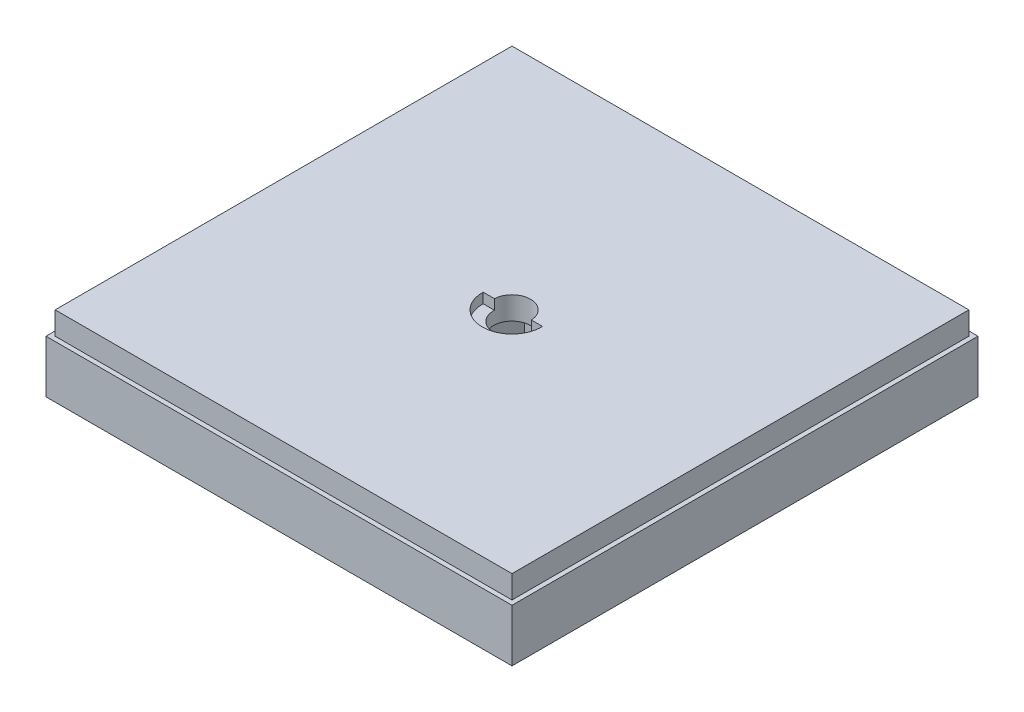
from build123d import *

# Parameters (mm, degrees)
SKETCH1_W           = 102
SKETCH1_H           = 102
BOSS_EXTRUDE1_DEPTH = 11.5
SKETCH2_W           = 100
SKETCH2_H           = 100
SKETCH2_R           = 4.05
BOSS_EXTRUDE2_DEPTH = 5
SKETCH3_R           = 8
CUT_EXTRUDE1_DEPTH  = 7
CUT_EXTRUDE2_DEPTH  = 2.2


with BuildPart() as part:
    # Sketch1 → Boss-Extrude1 (new body)
    with BuildSketch(Plane(origin=(0, 0, 0), x_dir=(1, 0, 0), z_dir=(0, 1, 0))):
        with Locations((-51, 51)):
            Rectangle(SKETCH1_W, SKETCH1_H)
        Polygon((-43.494446501, 51), (-47.24722325, 57.5), (-54.75277675, 57.5), (-58.505553499, 51), (-54.75277675, 44.5), (-47.24722325, 44.5), align=None, mode=Mode.SUBTRACT)
    extrude(amount=BOSS_EXTRUDE1_DEPTH)

    # Sketch2 → Boss-Extrude2 (add)
    with BuildSketch(Plane(origin=(0, 11.5, 0), x_dir=(1, 0, 0), z_dir=(0, 1, 0))):
        with Locations((-51, 51)):
            Rectangle(SKETCH2_W, SKETCH2_H)
        with Locations(Location((-51, 51, 0), (0, 0, 270))):
            Circle(SKETCH2_R, mode=Mode.SUBTRACT)
    extrude(amount=BOSS_EXTRUDE2_DEPTH)

    # Sketch3 → Cut-Extrude1 (cut)
    with BuildSketch(Plane.XZ):
        with Locations(Location((-51, -51, 0), (0, 0, 270))):
            Circle(SKETCH3_R)
    extrude(amount=-CUT_EXTRUDE1_DEPTH, mode=Mode.SUBTRACT)

    # Sketch4 → Cut-Extrude2 (cut)
    with BuildSketch(Plane(origin=(0, 16.5, 0), x_dir=(1, 0, 0), z_dir=(0, 1, 0))):
        with BuildLine():
            Line((-57.496922348, 51.2), (-44.503077652, 51.2))
            ThreePointArc((-44.503077652, 51.2), (-51, 44.5), (-57.496922348, 51.2))
        make_face()
    extrude(amount=-CUT_EXTRUDE2_DEPTH, mode=Mode.SUBTRACT)


solid = part.part
